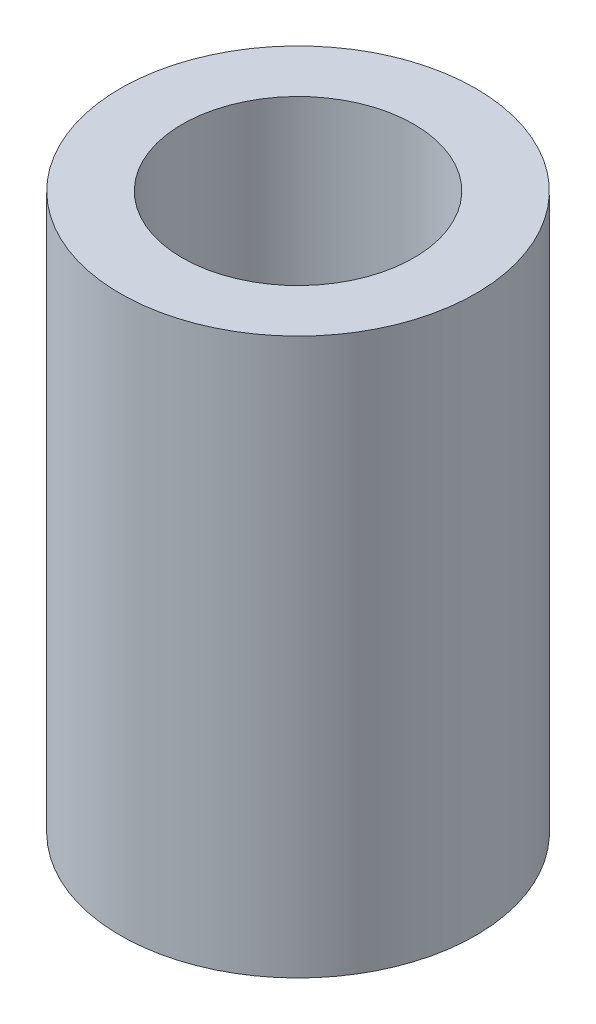
from build123d import *

# Parameters (mm, degrees)
SKETCH1_R           = 2.43608216
SKETCH1_R_2         = 1.5875
BOSS_EXTRUDE1_DEPTH = 7.62


with BuildPart() as part:
    # Sketch1 → Boss-Extrude1 (new body)
    with BuildSketch(Plane(origin=(0, 0, 0), x_dir=(1, 0, 0), z_dir=(0, 1, 0))):
        with Locations(Location((0, 0, 0), (0, 0, 90))):
            Circle(SKETCH1_R)
        with Locations(Location((0, 0, 0), (0, 0, 90))):
            Circle(SKETCH1_R_2, mode=Mode.SUBTRACT)
    extrude(amount=BOSS_EXTRUDE1_DEPTH)


solid = part.part
